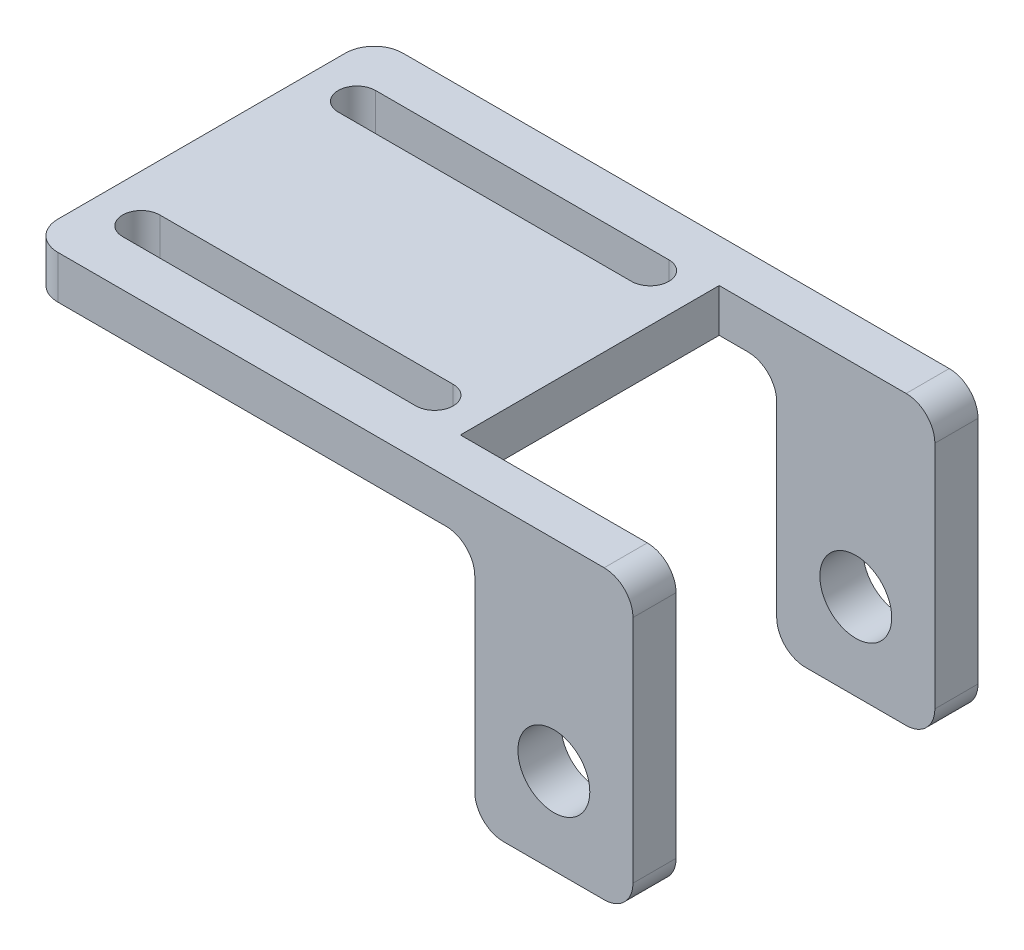
from build123d import *

# Parameters (mm, degrees)
SKETCH1_W           = 42
SKETCH1_H           = 24
BOSS_EXTRUDE1_DEPTH = 3
SKETCH2_W           = 11
SKETCH2_H           = 3
BOSS_EXTRUDE2_DEPTH = 17
SKETCH3_R           = 2.5
CUT_EXTRUDE1_DEPTH  = 52.273774973
SKETCH4_W           = 15
SKETCH4_H           = 18
CUT_EXTRUDE2_DEPTH  = 3
FILLET1_R           = 2
FILLET2_R           = 2
FILLET3_R           = 2
CUT_EXTRUDE3_DEPTH  = 53.345009313


with BuildPart() as part:
    # Sketch1 → Boss-Extrude1 (new body)
    with BuildSketch(Plane(origin=(0, 0, 0), x_dir=(1, 0, 0), z_dir=(0, 1, 0))):
        with Locations((21, 12)):
            Rectangle(SKETCH1_W, SKETCH1_H)
    extrude(amount=BOSS_EXTRUDE1_DEPTH)

    # Sketch2 → Boss-Extrude2 (add)
    with BuildSketch(Plane.XZ):
        with Locations((36.5, -1.5)):
            Rectangle(SKETCH2_W, SKETCH2_H)
        with Locations((36.5, -22.5)):
            Rectangle(SKETCH2_W, SKETCH2_H)
    extrude(amount=BOSS_EXTRUDE2_DEPTH)

    # Sketch3 → Cut-Extrude1 (cut, through all)
    with BuildSketch(Plane.XY):
        with Locations((36.5, -11)):
            Circle(SKETCH3_R)
    extrude(amount=-CUT_EXTRUDE1_DEPTH, mode=Mode.SUBTRACT)

    # Sketch4 → Cut-Extrude2 (cut)
    with BuildSketch(Plane(origin=(0, 3, 0), x_dir=(1, 0, 0), z_dir=(0, 1, 0))):
        with Locations((34.5, 12)):
            Rectangle(SKETCH4_W, SKETCH4_H)
    extrude(amount=-CUT_EXTRUDE2_DEPTH, mode=Mode.SUBTRACT)

    # Fillet1
    fillet1_edges = [part.edges().sort_by_distance(p)[0] for p in [
        (0, 1.5, -24),
        (0, 1.5, 0),
    ]]
    fillet(fillet1_edges, radius=FILLET1_R)

    # Fillet2
    fillet2_edges = [part.edges().sort_by_distance(p)[0] for p in [
        (42, 3, -1.5),
        (42, -17, -1.5),
        (31, -17, -1.5),
        (42, -17, -22.5),
        (31, -17, -22.5),
        (42, 3, -22.5),
    ]]
    fillet(fillet2_edges, radius=FILLET2_R)

    # Fillet3
    fillet3_edges = [part.edges().sort_by_distance(p)[0] for p in [
        (31, 0, -1.5),
        (31, 0, -22.5),
    ]]
    fillet(fillet3_edges, radius=FILLET3_R)

    # Sketch6 → Cut-Extrude3 (cut, through all)
    with BuildSketch(Plane(origin=(0, 3, 0), x_dir=(1, 0, 0), z_dir=(0, 1, 0))):
        with BuildLine():
            Line((3.3, 20.8), (23.7, 20.8))
            ThreePointArc((23.7, 20.8), (25, 19.5), (23.7, 18.2))
            Line((23.7, 18.2), (3.3, 18.2))
            ThreePointArc((3.3, 18.2), (2, 19.5), (3.3, 20.8))
        make_face()
        with BuildLine():
            Line((3.3, 5.8), (23.7, 5.8))
            ThreePointArc((23.7, 5.8), (25, 4.5), (23.7, 3.2))
            Line((23.7, 3.2), (3.3, 3.2))
            ThreePointArc((3.3, 3.2), (2, 4.5), (3.3, 5.8))
        make_face()
    extrude(amount=-CUT_EXTRUDE3_DEPTH, mode=Mode.SUBTRACT)


solid = part.part
